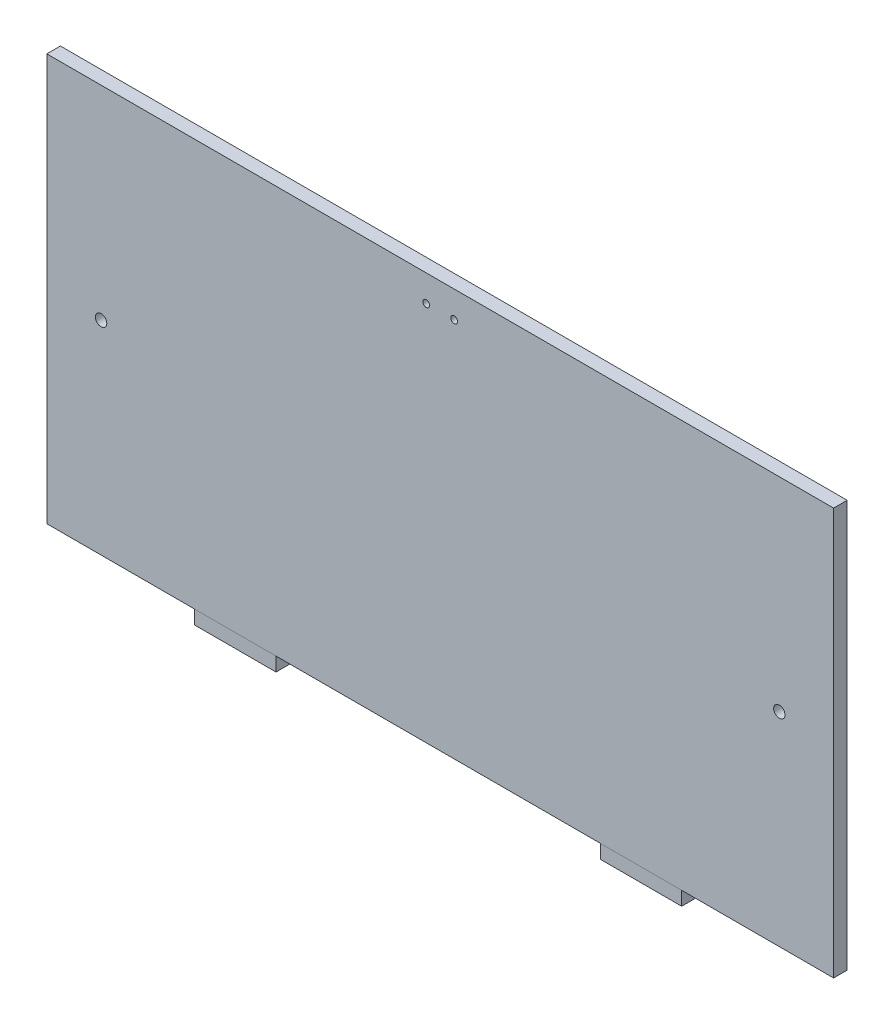
from build123d import *

# Parameters (mm, degrees)
SKETCH1_W             = 290
SKETCH1_H             = 150
BOSS_EXTRUDE1_DEPTH   = 5
CUT_EXTRUDE1_DEPTH    = 5
SKETCH3_W             = 30
SKETCH3_H             = 10.2
BOSS_EXTRUDE2_DEPTH   = 5
BOSS_EXTRUDE2_2_DEPTH = 5
SKETCH4_R             = 2.1
CUT_EXTRUDE2_DEPTH    = 10


with BuildPart() as part:
    # Sketch1 → Boss-Extrude1 (new body)
    with BuildSketch(Plane.XY):
        Rectangle(SKETCH1_W, SKETCH1_H)
    extrude(amount=BOSS_EXTRUDE1_DEPTH)

    # Sketch2 → Cut-Extrude1 (cut)
    with BuildSketch(Plane.XY.offset(5)):
        with BuildLine():
            Line((-6.4, 65.2), (-5.15, 65.2))
            Line((-5.15, 65.2), (-3.9, 65.2))
            ThreePointArc((-3.9, 65.2), (-5.15, 66.45), (-6.4, 65.2))
        make_face()
        with BuildLine():
            Line((-3.9, 65.2), (-5.15, 65.2))
            Line((-5.15, 65.2), (-6.4, 65.2))
            ThreePointArc((-6.4, 65.2), (-5.15, 63.95), (-3.9, 65.2))
        make_face()
        with BuildLine():
            ThreePointArc((6.4, 65.2), (5.15, 66.45), (3.9, 65.2))
            Line((3.9, 65.2), (5.15, 65.2))
            Line((5.15, 65.2), (6.4, 65.2))
        make_face()
        with BuildLine():
            Line((5.15, 65.2), (3.9, 65.2))
            ThreePointArc((3.9, 65.2), (5.15, 63.95), (6.4, 65.2))
            Line((6.4, 65.2), (5.15, 65.2))
        make_face()
    extrude(amount=-CUT_EXTRUDE1_DEPTH, mode=Mode.SUBTRACT)

    # Sketch4 → Cut-Extrude2 (cut)
    with BuildSketch(Plane(origin=(0, 0, 0), x_dir=(-1, 0, 0), z_dir=(0, 0, -1))):
        with Locations((-125, 0)):
            Circle(SKETCH4_R)
        with Locations(Location((125, 0, 0), (0, 0, 180))):
            Circle(SKETCH4_R)
    extrude(amount=-CUT_EXTRUDE2_DEPTH, mode=Mode.SUBTRACT)


with BuildPart() as body_2:
    # Sketch3 → Boss-Extrude2 (new body)
    with BuildSketch(Plane.XY.offset(5)):
        with Locations((-75.52, -75)):
            Rectangle(SKETCH3_W, SKETCH3_H)
    extrude(amount=-BOSS_EXTRUDE2_DEPTH)


with BuildPart() as body_3:
    # Sketch3 → Boss-Extrude2 2 (new body)
    with BuildSketch(Plane.XY.offset(5)):
        with Locations((74, -75)):
            Rectangle(SKETCH3_W, SKETCH3_H)
    extrude(amount=-BOSS_EXTRUDE2_2_DEPTH)


solid = Compound([part.part, body_2.part, body_3.part])
